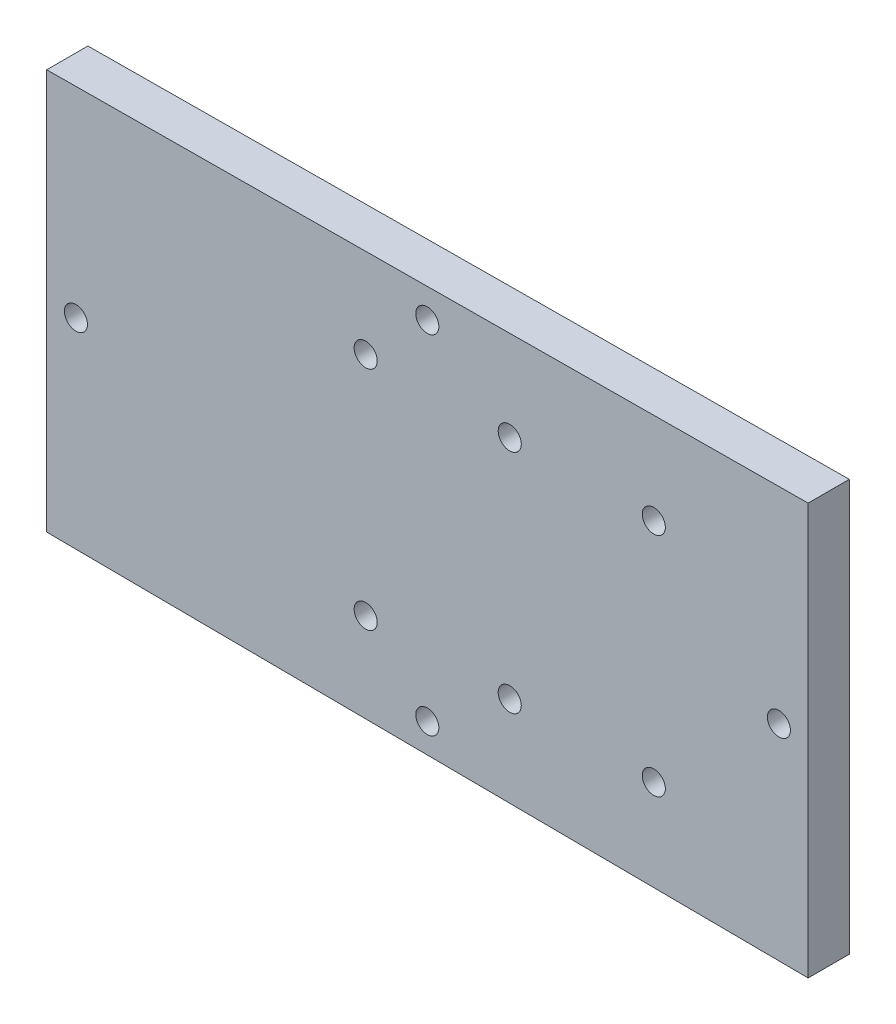
from build123d import *

# Parameters (mm, degrees)
BOSS_EXTRUDE2_DEPTH = 25.4
SKETCH2_R           = 7.1247
CUT_EXTRUDE1_DEPTH  = 25.4
SKETCH2_3_R         = 7.1247
CUT_EXTRUDE2_DEPTH  = 25.4
SKETCH2_4_R         = 7.1247
CUT_EXTRUDE3_DEPTH  = 25.4
SKETCH2_5_R         = 7.1247
CUT_EXTRUDE4_DEPTH  = 25.4
SKETCH2_6_R         = 7.1247
CUT_EXTRUDE5_DEPTH  = 25.4
SKETCH2_7_R         = 7.1247
CUT_EXTRUDE6_DEPTH  = 25.4
SKETCH2_8_R         = 7.1247
CUT_EXTRUDE7_DEPTH  = 25.4
SKETCH2_9_R         = 7.1247
CUT_EXTRUDE8_DEPTH  = 25.4
SKETCH2_10_R        = 7.1247
CUT_EXTRUDE9_DEPTH  = 25.4
SKETCH2_11_R        = 7.1247
CUT_EXTRUDE10_DEPTH = 25.4


with BuildPart() as part:
    # Pedal Box Floor → Boss-Extrude2 (new body)
    with BuildSketch(Plane.XY):
        Polygon((0, -126.908753769), (-469.9, -123.556557293), (-469.9, 123.556557293), (0, 126.908753769), align=None)
    extrude(amount=BOSS_EXTRUDE2_DEPTH)

    # Sketch2 → Cut-Extrude1 (cut)
    with BuildSketch(Plane.XY):
        with Locations((-235.026595282, 107.199301857)):
            Circle(SKETCH2_R)
    extrude(amount=CUT_EXTRUDE1_DEPTH, mode=Mode.SUBTRACT)

    # Sketch2<3> → Cut-Extrude2 (cut)
    with BuildSketch(Plane.XY):
        with Locations((-18.034, 0)):
            Circle(SKETCH2_3_R)
    extrude(amount=CUT_EXTRUDE2_DEPTH, mode=Mode.SUBTRACT)

    # Sketch2<4> → Cut-Extrude3 (cut)
    with BuildSketch(Plane.XY):
        with Locations((-451.866, 0)):
            Circle(SKETCH2_4_R)
    extrude(amount=CUT_EXTRUDE3_DEPTH, mode=Mode.SUBTRACT)

    # Sketch2<5> → Cut-Extrude4 (cut)
    with BuildSketch(Plane.XY):
        with Locations((-235.026595282, -107.200076916)):
            Circle(SKETCH2_5_R)
    extrude(amount=CUT_EXTRUDE4_DEPTH, mode=Mode.SUBTRACT)

    # Sketch2<6> → Cut-Extrude5 (cut)
    with BuildSketch(Plane.XY):
        with Locations((-273.05, -69.85)):
            Circle(SKETCH2_6_R)
    extrude(amount=CUT_EXTRUDE5_DEPTH, mode=Mode.SUBTRACT)

    # Sketch2<7> → Cut-Extrude6 (cut)
    with BuildSketch(Plane.XY):
        with Locations((-184.15, -69.85)):
            Circle(SKETCH2_7_R)
    extrude(amount=CUT_EXTRUDE6_DEPTH, mode=Mode.SUBTRACT)

    # Sketch2<8> → Cut-Extrude7 (cut)
    with BuildSketch(Plane.XY):
        with Locations((-95.25, -69.85)):
            Circle(SKETCH2_8_R)
    extrude(amount=CUT_EXTRUDE7_DEPTH, mode=Mode.SUBTRACT)

    # Sketch2<9> → Cut-Extrude8 (cut)
    with BuildSketch(Plane.XY):
        with Locations((-273.05, 69.85)):
            Circle(SKETCH2_9_R)
    extrude(amount=CUT_EXTRUDE8_DEPTH, mode=Mode.SUBTRACT)

    # Sketch2<10> → Cut-Extrude9 (cut)
    with BuildSketch(Plane.XY):
        with Locations((-184.15, 69.85)):
            Circle(SKETCH2_10_R)
    extrude(amount=CUT_EXTRUDE9_DEPTH, mode=Mode.SUBTRACT)

    # Sketch2<11> → Cut-Extrude10 (cut)
    with BuildSketch(Plane.XY):
        with Locations((-95.25, 69.85)):
            Circle(SKETCH2_11_R)
    extrude(amount=CUT_EXTRUDE10_DEPTH, mode=Mode.SUBTRACT)


solid = part.part
